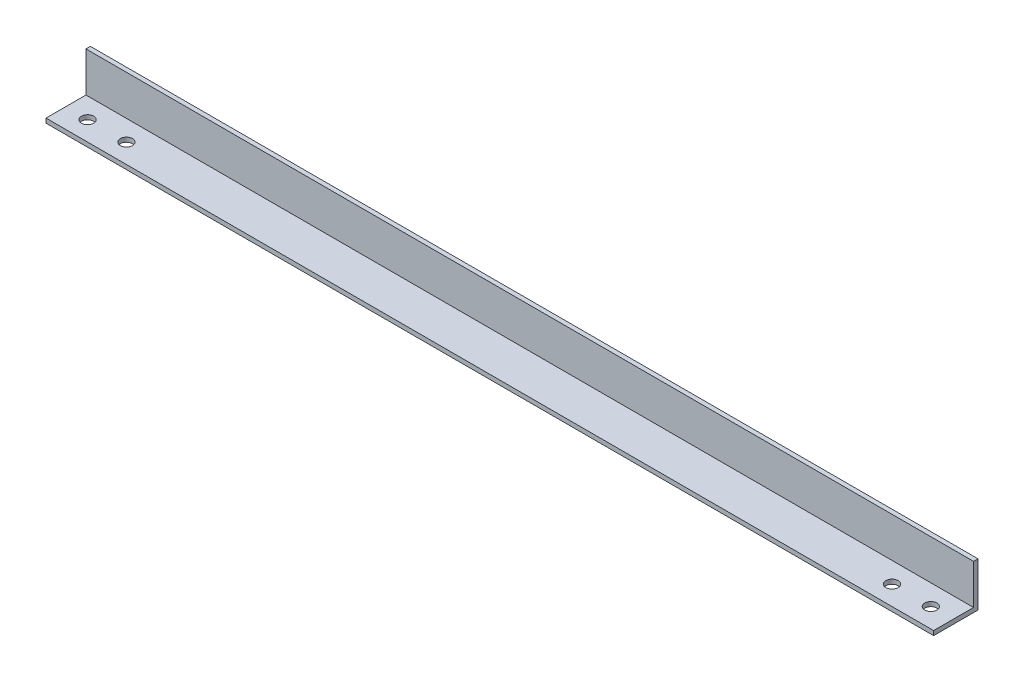
from build123d import *

# Parameters (mm, degrees)
SKETCH_174_W        = 1600
SKETCH_174_H        = 80
EXTRUDE_4_DEPTH     = 8
SKETCH_3_W          = 1600
SKETCH_3_H          = 8
EXTRUDE_5_DEPTH     = 72
SKETCH_4_R          = 11
CUT_EXTRUDE_2_DEPTH = 1604.615914114


with BuildPart() as part:
    # Sketch 174 → 拉伸4 (new body)
    with BuildSketch(Plane.XY):
        with Locations((800, 40)):
            Rectangle(SKETCH_174_W, SKETCH_174_H)
    extrude(amount=EXTRUDE_4_DEPTH)

    # 草图3 → 拉伸5 (add)
    with BuildSketch(Plane.XY.offset(8)):
        with Locations((800, 4)):
            Rectangle(SKETCH_3_W, SKETCH_3_H)
    extrude(amount=EXTRUDE_5_DEPTH)

    # 草图4 → 切除-拉伸2 (cut, through all)
    with BuildSketch(Plane(origin=(0, 8, 0), x_dir=(1, 0, 0), z_dir=(0, 1, 0))):
        with Locations(Location((40, -45, 0), (0, 0, 270))):
            Circle(SKETCH_4_R)
        with Locations(Location((110, -45, 0), (0, 0, 270))):
            Circle(SKETCH_4_R)
        with Locations(Location((1490, -45, 0), (0, 0, 270))):
            Circle(SKETCH_4_R)
        with Locations(Location((1560, -45, 0), (0, 0, 270))):
            Circle(SKETCH_4_R)
    extrude(amount=-CUT_EXTRUDE_2_DEPTH, mode=Mode.SUBTRACT)


solid = part.part
